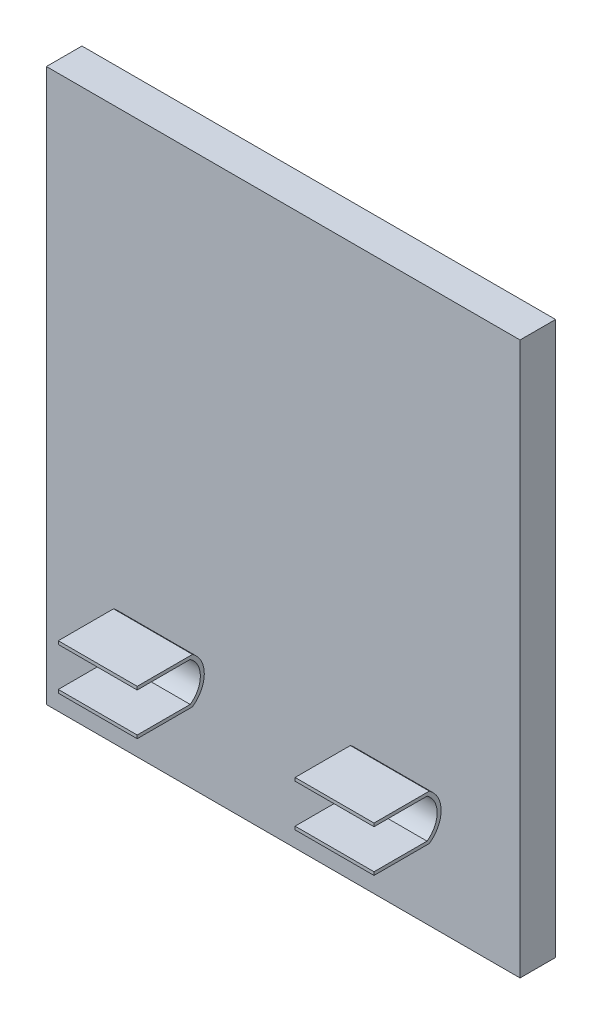
from build123d import *

# Parameters (mm, degrees)
SKETCH1_W           = 120
SKETCH1_H           = 140
BOSS_EXTRUDE1_DEPTH = 9
SKETCH3_W           = 9
SKETCH3_H           = 21
BOSS_EXTRUDE2_DEPTH = 120
SKETCH4_W           = 17
SKETCH4_H           = 11.505030619
CUT_EXTRUDE1_DEPTH  = 20
SKETCH5_W           = 17
SKETCH5_H           = 11.703302947
CUT_EXTRUDE2_DEPTH  = 20
SKETCH6_W           = 40
SKETCH6_H           = 7
SKETCH6_H_2         = 10
CUT_EXTRUDE3_DEPTH  = 80
BOSS_EXTRUDE3_DEPTH = 1.15


with BuildPart() as part:
    # Sketch1 → Boss-Extrude1 (new body)
    with BuildSketch(Plane.XY):
        with Locations((60, 70)):
            Rectangle(SKETCH1_W, SKETCH1_H)
    extrude(amount=BOSS_EXTRUDE1_DEPTH)

    # Sketch3 → Boss-Extrude2 (add)
    with BuildSketch(Plane(origin=(120, 0, 0), x_dir=(0, 0, -1), z_dir=(1, 0, 0))):
        with Locations((-4.5, 10.5)):
            Rectangle(SKETCH3_W, SKETCH3_H)
        with BuildLine():
            Line((-12.572359528, 21.820002787), (-26, 21.820002787))
            Line((-26, 21.820002787), (-26, 21))
            Line((-26, 21), (-12, 21))
            ThreePointArc((-12, 21), (-9, 26.75251531), (-12, 32.505030619))
            Line((-12, 32.505030619), (-26, 32.505030619))
            Line((-26, 32.505030619), (-26, 31.685027833))
            Line((-26, 31.685027833), (-12.572359528, 31.685027833))
            ThreePointArc((-12.572359528, 31.685027833), (-10, 26.75251531), (-12.572359528, 21.820002787))
        make_face()
    extrude(amount=-BOSS_EXTRUDE2_DEPTH)


with BuildPart() as boss_extrude2_piece_1:
    # of the separate pieces the step leaves, piece 1, a body of its own (boss_extrude2_pieces)
    add(part.part.solids().sort_by_distance((0, 0, 0))[0])

    # Sketch12 → Boss-Extrude3 (add)
    # profile 1 of 3: a face of its own
    with BuildSketch(Plane(origin=(0, 0, 0), x_dir=(-1, 0, 0), z_dir=(0, 0, -1))):
        Polygon((-88.695411942, 76.852795692), (-81.52971128, 76.852795692), (-81.52971128, 80.325278986), (-88.695411942, 80.325278986), (-88.695411942, 86.292551988), (-81.005391719, 86.292551988), (-81.005391719, 89.765039397), (-92.977021672, 89.765039397), (-92.977021672, 67.502430195), (-88.695411942, 67.502430195), align=None)
    # profile 2 of 3: a face of its own
    with BuildSketch(Plane(origin=(0, 0, 0), x_dir=(-1, 0, 0), z_dir=(0, 0, -1))):
        with BuildLine():
            Line((-62.228105887, 80.030286473), (-62.228105887, 76.608373324))
            Line((-62.228105887, 76.608373324), (-58.993888309, 76.608373324))
            Line((-58.993888309, 76.608373324), (-58.993888309, 70.94705217))
            add(Edge.make_bspline(
                [(-58.993888309, 70.94705217), (-59.049454904, 70.920680257), (-59.167380243, 70.864712876), (-59.37064488, 70.810473879), (-59.60050764, 70.754347306), (-59.862544621, 70.709774765), (-60.154681352, 70.67018452), (-60.478560933, 70.648907948), (-60.833796823, 70.6254502), (-61.081259163, 70.619121488), (-61.210538103, 70.615815251)],
                knots=[0, 0, 0, 0, 0.653154628, 1.386147199, 2.230860804, 3.172021168, 4.212071664, 5.366447579, 6.624183111, 8, 8, 8, 8], degree=3))
            add(Edge.make_bspline(
                [(-61.210538103, 70.615815251), (-61.441309698, 70.620478788), (-61.895157817, 70.629650357), (-62.556702781, 70.731485142), (-63.188411472, 70.884343379), (-63.784081053, 71.112082953), (-64.35209803, 71.392047653), (-64.882907462, 71.743378279), (-65.38222771, 72.153574102), (-65.846619163, 72.627253944), (-66.269843406, 73.161076514), (-66.632692468, 73.763379217), (-66.94625147, 74.423540907), (-67.199769554, 75.147935278), (-67.408651824, 75.929168971), (-67.551078474, 76.773078944), (-67.651079608, 77.676495901), (-67.669699555, 78.300786906), (-67.679302492, 78.622754885)],
                knots=[0, 0, 0, 0, 0.953676512, 1.87555272, 2.761867879, 3.637011316, 4.507417159, 5.37595959, 6.263416516, 7.1754643, 8.114589267, 9.074123104, 10.077253866, 11.132050585, 12.243927563, 13.417825685, 14.668285404, 16, 16, 16, 16], degree=3))
            add(Edge.make_bspline(
                [(-67.679302492, 78.622754885), (-67.668454803, 78.941930629), (-67.647417992, 79.56090488), (-67.541339454, 80.45557355), (-67.378931363, 81.286270942), (-67.156828774, 82.049690037), (-66.878576635, 82.750725055), (-66.536344842, 83.383228022), (-66.140105129, 83.956735399), (-65.674865325, 84.453628968), (-65.168468493, 84.891409975), (-64.627886209, 85.274152926), (-64.048268469, 85.591441114), (-63.437217931, 85.852701466), (-62.790924955, 86.05693235), (-62.110441749, 86.198262279), (-61.395415717, 86.284882966), (-60.907368444, 86.292758261), (-60.658480686, 86.296774397)],
                knots=[0, 0, 0, 0, 1.298542789, 2.518250729, 3.66010011, 4.737713637, 5.747803493, 6.721842567, 7.65708385, 8.574936643, 9.482253959, 10.376304947, 11.263703582, 12.164756428, 13.075521448, 14.015723889, 14.988085666, 16, 16, 16, 16], degree=3))
            add(Edge.make_bspline(
                [(-60.658480686, 86.296774397), (-60.423846249, 86.292982484), (-59.972448813, 86.285687477), (-59.323685176, 86.246003305), (-58.73213302, 86.172310965), (-58.192197932, 86.083207736), (-57.700682261, 85.95973964), (-57.244107601, 85.833768088), (-56.82581692, 85.680669124), (-56.563139291, 85.564840995), (-56.435873574, 85.50872297)],
                knots=[0, 0, 0, 0, 1.300829087, 2.50257772, 3.600788493, 4.604486954, 5.533740486, 6.408714025, 7.229031605, 8, 8, 8, 8], degree=3))
            Line((-56.435873574, 85.50872297), (-55.551064767, 89.080840314))
            add(Edge.make_bspline(
                [(-55.551064767, 89.080840314), (-55.696395445, 89.146190732), (-56.002646143, 89.283901582), (-56.501862827, 89.467244068), (-57.070606668, 89.617251632), (-57.697903219, 89.761878571), (-58.382827249, 89.87907774), (-59.117239223, 89.962081851), (-59.899248295, 90.012182384), (-60.436459834, 90.021514237), (-60.71326501, 90.026322595)],
                knots=[0, 0, 0, 0, 0.723124712, 1.523817615, 2.410092779, 3.390664769, 4.445079126, 5.5617063, 6.743637714, 8, 8, 8, 8], degree=3))
            add(Edge.make_bspline(
                [(-60.71326501, 90.026322595), (-61.116857634, 90.016386158), (-61.908377866, 89.996898955), (-63.067535851, 89.85048957), (-64.171580335, 89.61514218), (-65.223307782, 89.290072765), (-66.2213054, 88.873749165), (-67.161926492, 88.358372415), (-68.051276763, 87.758390774), (-68.742820555, 87.184319619), (-69.259147718, 86.679440159), (-69.624715749, 86.279737215), (-69.969508501, 85.861206771), (-70.283439384, 85.418696989), (-70.575482007, 84.956982143), (-70.845855816, 84.476762367), (-71.090709345, 83.97438239), (-71.308406419, 83.449877613), (-71.509187066, 82.907330796), (-71.674463979, 82.341322193), (-71.822577067, 81.758124073), (-71.951317614, 81.155765345), (-72.04488941, 80.530422121), (-72.122105949, 79.885567055), (-72.17312688, 79.219094572), (-72.186104957, 78.767524878), (-72.192687938, 78.53847131)],
                knots=[0, 0, 0, 0, 1.588252423, 3.114858529, 4.590810091, 6.026612173, 7.441653233, 8.839609889, 10.241268389, 11.658554554, 12.370162762, 13.082415096, 13.78967092, 14.503124065, 15.216405789, 15.939266766, 16.671226771, 17.414686674, 18.173812935, 18.947024519, 19.734205331, 20.542085796, 21.370222467, 22.222016626, 23.098138246, 24, 24, 24, 24], degree=3))
            add(Edge.make_bspline(
                [(-72.192687938, 78.53847131), (-72.181179414, 78.091388891), (-72.158641518, 77.215838149), (-72.011130132, 75.933743636), (-71.76091797, 74.715049127), (-71.476272362, 73.743690519), (-71.201347574, 73.005039073), (-70.97178856, 72.479704669), (-70.724166559, 71.978327917), (-70.454762218, 71.500843148), (-70.161377809, 71.050307471), (-69.857041742, 70.617706876), (-69.521246529, 70.216318759), (-69.28206698, 69.965559376), (-69.162693413, 69.84040636)],
                knots=[0, 0, 0, 0, 1.704842656, 3.338704885, 4.913464543, 6.443981355, 7.193187298, 7.917665265, 8.629154765, 9.324799911, 10.00680261, 10.678695983, 11.34054239, 12, 12, 12, 12], degree=3))
            add(Edge.make_bspline(
                [(-69.162693413, 69.84040636), (-68.9219195, 69.620660501), (-68.439709356, 69.180564311), (-67.620430405, 68.629624676), (-66.733871847, 68.163655725), (-65.77675141, 67.78515183), (-64.749398545, 67.489307045), (-63.651999862, 67.281372578), (-62.483339675, 67.156647541), (-61.681440377, 67.147850597), (-61.269536606, 67.143331957)],
                knots=[0, 0, 0, 0, 0.913036649, 1.828584863, 2.758893342, 3.717094375, 4.709404796, 5.752305212, 6.845448596, 8, 8, 8, 8], degree=3))
            add(Edge.make_bspline(
                [(-61.269536606, 67.143331957), (-60.951922044, 67.149939655), (-60.327153083, 67.162937437), (-59.40765313, 67.237372095), (-58.520200634, 67.345595787), (-57.674174039, 67.492209468), (-56.886472038, 67.663938477), (-56.175417198, 67.844307576), (-55.548490413, 68.026426174), (-55.165385477, 68.165528054), (-54.986196082, 68.230590075)],
                knots=[0, 0, 0, 0, 1.189863118, 2.340539873, 3.45407261, 4.538092694, 5.555811396, 6.473485662, 7.286004554, 8, 8, 8, 8], degree=3))
            Line((-54.986196082, 68.230590075), (-54.981986019, 80.030286473))
            Line((-54.981986019, 80.030286473), (-62.228105887, 80.030286473))
        make_face()
    # profile 3 of 3: a face of its own
    with BuildSketch(Plane(origin=(0, 0, 0), x_dir=(-1, 0, 0), z_dir=(0, 0, -1))):
        with BuildLine():
            Line((-40.687487567, 67.256946051), (-40.687487567, 75.647540568))
            add(Edge.make_bspline(
                [(-40.687487567, 75.647540568), (-40.575416732, 75.625565919), (-40.340038068, 75.579413292), (-39.966970768, 75.555130282), (-39.562820309, 75.523227983), (-39.282850076, 75.524611255), (-39.136669786, 75.5253335)],
                knots=[0, 0, 0, 0, 0.878556077, 1.845202224, 2.874919808, 4, 4, 4, 4], degree=3))
            add(Edge.make_bspline(
                [(-39.136669786, 75.5253335), (-38.911846526, 75.521884698), (-38.460167343, 75.514955914), (-37.780772205, 75.567442751), (-37.098917088, 75.673280052), (-36.416342163, 75.834866346), (-35.73231143, 76.046518159), (-35.046173352, 76.308567229), (-34.361059517, 76.627508782), (-33.676188696, 76.985557741), (-33.020215553, 77.415152967), (-32.44924182, 77.961087321), (-31.948833944, 78.589248223), (-31.540917082, 79.317389493), (-31.206035308, 80.133558645), (-30.958283987, 81.043963628), (-30.783422028, 82.044416328), (-30.736763653, 82.743496381), (-30.712526455, 83.10664108)],
                knots=[0, 0, 0, 0, 0.841321464, 1.69024945, 2.54697463, 3.421933785, 4.313421963, 5.225513963, 6.16898692, 7.140527675, 8.117658811, 9.092268315, 10.084297122, 11.113479625, 12.205185911, 13.378908979, 14.638445907, 16, 16, 16, 16], degree=3))
            add(Edge.make_bspline(
                [(-30.712526455, 83.10664108), (-30.719780442, 83.362721617), (-30.734037999, 83.866042412), (-30.847003166, 84.600098906), (-31.022892519, 85.298678603), (-31.271860851, 85.955421279), (-31.583424713, 86.567072792), (-31.951033927, 87.126191286), (-32.373847355, 87.63248862), (-32.701819728, 87.919076435), (-32.865971798, 88.062515295)],
                knots=[0, 0, 0, 0, 1.10039744, 2.162807532, 3.18512533, 4.192295778, 5.175353367, 6.130031606, 7.064069995, 8, 8, 8, 8], degree=3))
            add(Edge.make_bspline(
                [(-32.865971798, 88.062515295), (-33.052646039, 88.20183135), (-33.431521565, 88.484588325), (-34.068528046, 88.83354015), (-34.766490737, 89.128139707), (-35.528867174, 89.366846852), (-36.35454027, 89.553317585), (-37.244391552, 89.67369332), (-38.196852158, 89.753108292), (-38.852738363, 89.758199901), (-39.191454109, 89.760829334)],
                knots=[0, 0, 0, 0, 0.836606025, 1.697982253, 2.603178176, 3.556730869, 4.566307281, 5.642647, 6.782605007, 8, 8, 8, 8], degree=3))
            add(Edge.make_bspline(
                [(-39.191454109, 89.760829334), (-39.490693723, 89.758113191), (-40.071053662, 89.752845371), (-40.918071207, 89.720464941), (-41.7145988, 89.683107722), (-42.463896063, 89.639806767), (-43.160461663, 89.574725483), (-43.809817654, 89.503916013), (-44.409061274, 89.422609983), (-44.790923052, 89.352044131), (-44.973307361, 89.318340564)],
                knots=[0, 0, 0, 0, 1.236942669, 2.398987101, 3.50349081, 4.533253662, 5.501087568, 6.394974819, 7.233410034, 8, 8, 8, 8], degree=3))
            Line((-44.973307361, 89.318340564), (-44.969097298, 67.256946051))
            Line((-44.969097298, 67.256946051), (-40.687487567, 67.256946051))
        make_face()
        with BuildLine():
            add(Edge.make_bspline(
                [(-40.687487567, 86.386778391), (-40.581043589, 86.410615781), (-40.33779512, 86.465089588), (-39.921175705, 86.507514669), (-39.414168149, 86.54865008), (-39.045489335, 86.55475069), (-38.845891451, 86.55805348)],
                knots=[0, 0, 0, 0, 0.70585537, 1.613038518, 2.7077303, 4, 4, 4, 4], degree=3))
            add(Edge.make_bspline(
                [(-38.845891451, 86.55805348), (-38.701045511, 86.556543468), (-38.417578332, 86.553588337), (-38.005276493, 86.503776957), (-37.615687033, 86.434770604), (-37.251487142, 86.333500672), (-36.911305215, 86.202158152), (-36.595626029, 86.041755139), (-36.29990254, 85.855314683), (-36.032123125, 85.636513792), (-35.788760086, 85.390550534), (-35.578072314, 85.115870741), (-35.398514301, 84.813634933), (-35.256935612, 84.482473031), (-35.142388518, 84.125580732), (-35.058472086, 83.741930638), (-35.008241607, 83.329879207), (-34.998933325, 83.046377726), (-34.99413207, 82.900146321)],
                knots=[0, 0, 0, 0, 1.150647283, 2.251845908, 3.296564491, 4.293585939, 5.251638342, 6.190496202, 7.10431693, 8.025138136, 8.933209785, 9.848938853, 10.770098533, 11.720244083, 12.705502524, 13.745915437, 14.837332513, 16, 16, 16, 16], degree=3))
            add(Edge.make_bspline(
                [(-34.99413207, 82.900146321), (-34.999177316, 82.751146692), (-35.009058259, 82.459335967), (-35.056833577, 82.033947851), (-35.147819431, 81.633912075), (-35.267258272, 81.258507553), (-35.427179434, 80.910436119), (-35.610574499, 80.582034432), (-35.836633684, 80.282457137), (-36.093559248, 80.008055609), (-36.382222363, 79.762566753), (-36.69920751, 79.546137303), (-37.04634623, 79.365419407), (-37.4222435, 79.216845829), (-37.824437083, 79.10037682), (-38.255781449, 79.015174823), (-38.714134727, 78.965962348), (-39.029796295, 78.956372181), (-39.191454109, 78.951460828)],
                knots=[0, 0, 0, 0, 1.095951735, 2.146384348, 3.141117811, 4.107846426, 5.036936284, 5.952845255, 6.867880406, 7.788493674, 8.711536769, 9.648229827, 10.604475232, 11.582556545, 12.615324965, 13.678675286, 14.811194273, 16, 16, 16, 16], degree=3))
            add(Edge.make_bspline(
                [(-39.191454109, 78.951460828), (-39.337599788, 78.951312335), (-39.616019296, 78.951029446), (-40.012167548, 78.974739559), (-40.366545398, 79.001990245), (-40.585211146, 79.045086339), (-40.687487567, 79.065243654)],
                knots=[0, 0, 0, 0, 1.166410307, 2.222107342, 3.16842715, 4, 4, 4, 4], degree=3))
            Line((-40.687487567, 79.065243654), (-40.687487567, 86.386778391))
        make_face(mode=Mode.SUBTRACT)
    extrude(amount=BOSS_EXTRUDE3_DEPTH)


with BuildPart() as boss_extrude2_piece_2:
    # of the separate pieces the step leaves, piece 2, a body of its own (boss_extrude2_pieces)
    add(part.part.solids().sort_by_distance((120, 21, 12))[0])

    # Sketch4 → Cut-Extrude1 (cut)
    with BuildSketch(Plane(origin=(120, 0, 0), x_dir=(0, 0, -1), z_dir=(1, 0, 0))):
        with Locations((-17.5, 26.75251531)):
            Rectangle(SKETCH4_W, SKETCH4_H)
    extrude(amount=-CUT_EXTRUDE1_DEPTH, mode=Mode.SUBTRACT)

    # Sketch5 → Cut-Extrude2 (cut)
    with BuildSketch(Plane.ZY):
        with Locations((17.5, 26.851651474)):
            Rectangle(SKETCH5_W, SKETCH5_H)
    extrude(amount=-CUT_EXTRUDE2_DEPTH, mode=Mode.SUBTRACT)

    # Sketch6 → Cut-Extrude3 (cut)
    with BuildSketch(Plane.XZ):
        with Locations((60, 22.5)):
            Rectangle(SKETCH6_W, SKETCH6_H)
        with Locations((60, 14)):
            Rectangle(SKETCH6_W, SKETCH6_H_2)
    extrude(amount=-CUT_EXTRUDE3_DEPTH, mode=Mode.SUBTRACT)


with BuildPart() as cut_extrude3_piece_1:
    # of the separate pieces the step leaves, piece 1, a body of its own (cut_extrude3_pieces)
    add(boss_extrude2_piece_2.part.solids().sort_by_distance((100, 21, 12))[0])


with BuildPart() as cut_extrude3_piece_2:
    # of the separate pieces the step leaves, piece 2, a body of its own (cut_extrude3_pieces)
    add(boss_extrude2_piece_2.part.solids().sort_by_distance((40, 32.505030619, 12))[0])


solid = Compound([boss_extrude2_piece_1.part, cut_extrude3_piece_1.part, cut_extrude3_piece_2.part])
